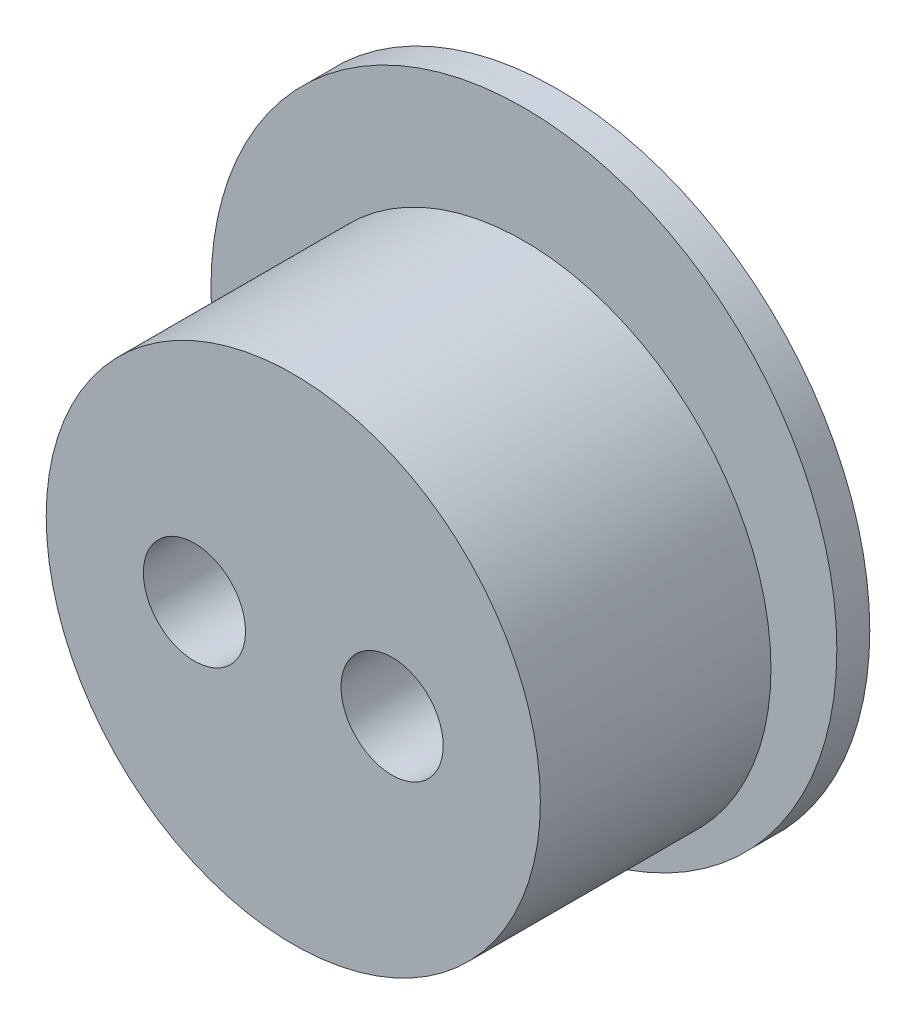
from build123d import *

# Parameters (mm, degrees)
SKETCH1_R           = 9.5
BOSS_EXTRUDE1_DEPTH = 1
SKETCH2_R           = 7.5
BOSS_EXTRUDE2_DEPTH = 7
SKETCH3_R           = 1.55
CUT_EXTRUDE1_DEPTH  = 16.636495771


with BuildPart() as part:
    # Sketch1 → Boss-Extrude1 (new body)
    with BuildSketch(Plane.XY):
        Circle(SKETCH1_R)
    extrude(amount=BOSS_EXTRUDE1_DEPTH)

    # Sketch2 → Boss-Extrude2 (add)
    with BuildSketch(Plane.XY.offset(1)):
        with Locations((0, -1.5)):
            Circle(SKETCH2_R)
    extrude(amount=BOSS_EXTRUDE2_DEPTH)

    # Sketch3 → Cut-Extrude1 (cut, through all)
    with BuildSketch(Plane.XY.offset(8)):
        with Locations((3, -1.5)):
            Circle(SKETCH3_R)
        with Locations(Location((-3, -1.5, 0), (0, 0, 180))):
            Circle(SKETCH3_R)
    extrude(amount=-CUT_EXTRUDE1_DEPTH, mode=Mode.SUBTRACT)


solid = part.part
